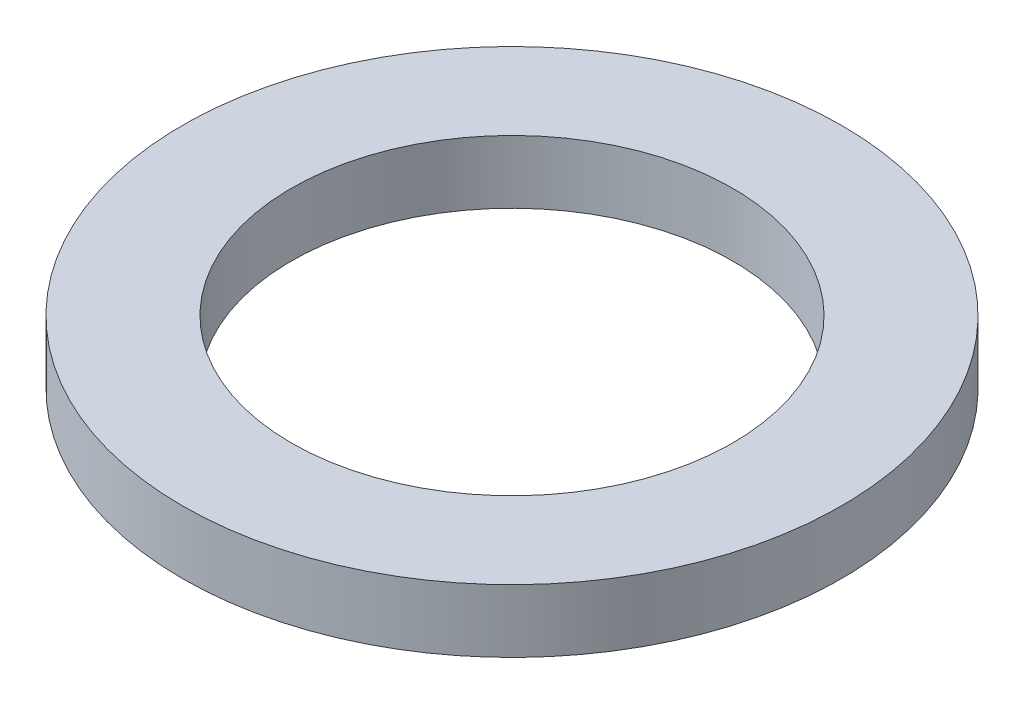
from build123d import *

# Parameters (mm, degrees)
SKETCH1_R           = 11.5
SKETCH1_R_2         = 7.7
BOSS_EXTRUDE1_DEPTH = 2.2


with BuildPart() as part:
    # Sketch1 → Boss-Extrude1 (new body)
    with BuildSketch(Plane(origin=(0, 0, 0), x_dir=(1, 0, 0), z_dir=(0, 1, 0))):
        with Locations(Location((0, 0, 0), (0, 0, 270))):
            Circle(SKETCH1_R)
        with Locations(Location((0, 0, 0), (0, 0, 270))):
            Circle(SKETCH1_R_2, mode=Mode.SUBTRACT)
    extrude(amount=BOSS_EXTRUDE1_DEPTH)


solid = part.part
